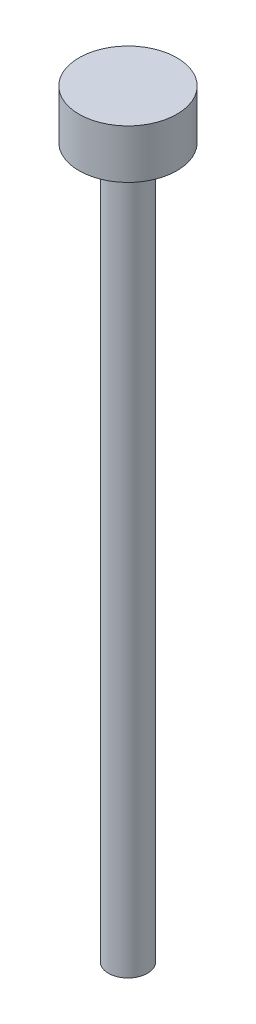
from build123d import *

# Parameters (mm, degrees)
SKETCH1_R           = 2.032
BOSS_EXTRUDE1_DEPTH = 73.66
SKETCH2_R           = 5.08
BOSS_EXTRUDE2_DEPTH = 5.08


with BuildPart() as part:
    # Sketch1 → Boss-Extrude1 (new body)
    with BuildSketch(Plane(origin=(0, 0, 0), x_dir=(1, 0, 0), z_dir=(0, 1, 0))):
        with Locations(Location((0, 0, 0), (0, 0, 270))):
            Circle(SKETCH1_R)
    extrude(amount=BOSS_EXTRUDE1_DEPTH)

    # Sketch2 → Boss-Extrude2 (add)
    with BuildSketch(Plane(origin=(0, 73.66, 0), x_dir=(1, 0, 0), z_dir=(0, 1, 0))):
        with Locations(Location((0, 0, 0), (0, 0, 270))):
            Circle(SKETCH2_R)
    extrude(amount=BOSS_EXTRUDE2_DEPTH)


solid = part.part
